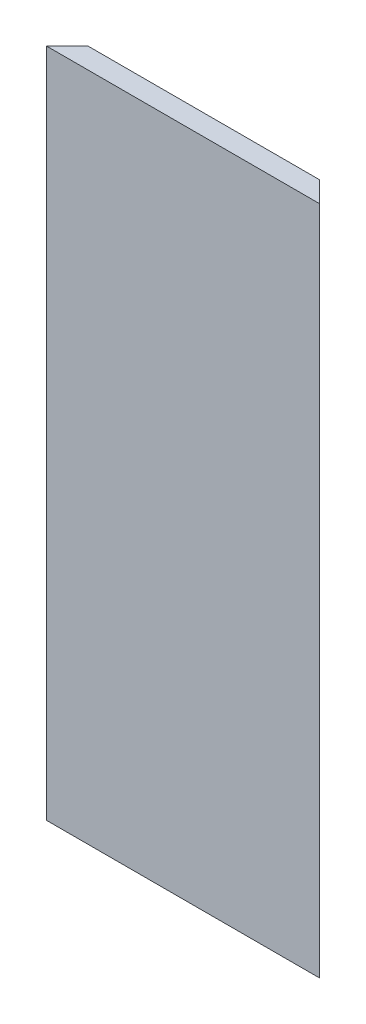
from build123d import *

# Parameters (mm, degrees)
BOSS_EXTRUDE1_DEPTH = 55


with BuildPart() as part:
    # Sketch1 → Boss-Extrude1 (new body)
    with BuildSketch(Plane(origin=(0, 0, 0), x_dir=(1, 0, 0), z_dir=(0, 1, 0))):
        Polygon((-11.2, -0.85), (-9.5, 0.85), (9.5, 0.85), (11.2, -0.85), align=None)
    extrude(amount=BOSS_EXTRUDE1_DEPTH)


solid = part.part
